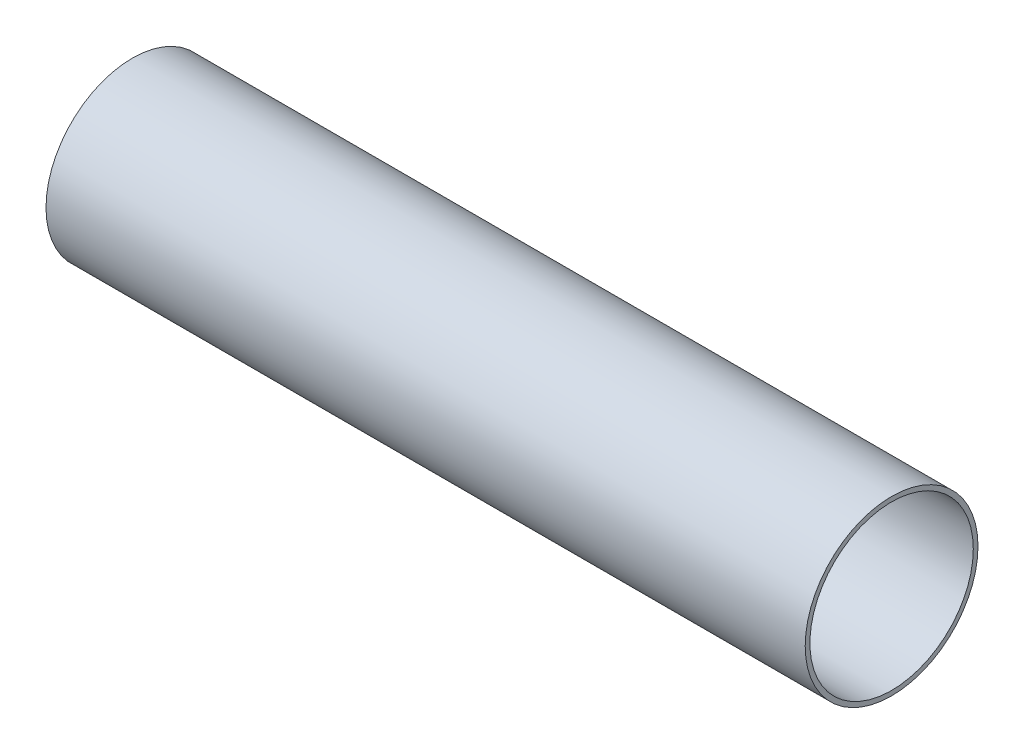
from build123d import *

# Parameters (mm, degrees)
SKETCH1_R           = 28.9052
SKETCH1_R_2         = 27.3304
BOSS_EXTRUDE1_DEPTH = 254


with BuildPart() as part:
    # Sketch1 → Boss-Extrude1 (new body)
    with BuildSketch(Plane.YZ):
        with Locations(Location((0, 0, 0), (0, 0, 270))):
            Circle(SKETCH1_R)
        with Locations(Location((0, 0, 0), (0, 0, 270))):
            Circle(SKETCH1_R_2, mode=Mode.SUBTRACT)
    extrude(amount=BOSS_EXTRUDE1_DEPTH)


solid = part.part
